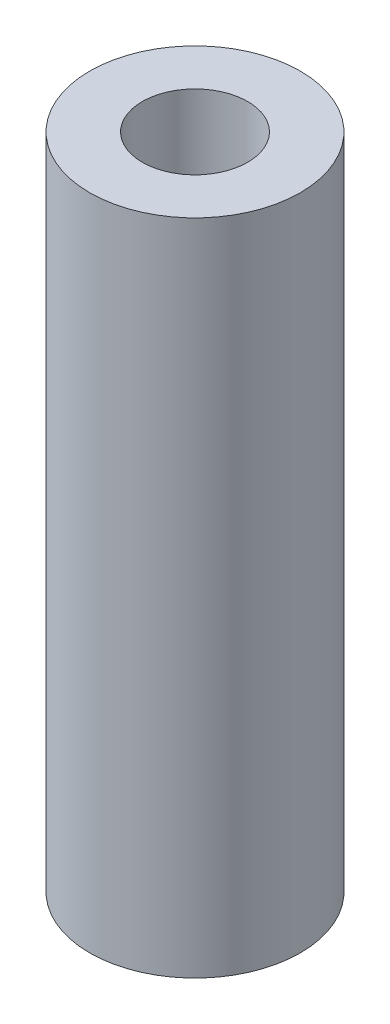
from build123d import *

# Parameters (mm, degrees)
SKETCH_1_R      = 4
SKETCH_1_R_2    = 2
EXTRUDE_1_DEPTH = 25


with BuildPart() as part:
    # 草图1 → 凸台-拉伸1 (new body)
    with BuildSketch(Plane(origin=(0, 0, 0), x_dir=(1, 0, 0), z_dir=(0, 1, 0))):
        with Locations(Location((0, 0, 0), (0, 0, 270))):
            Circle(SKETCH_1_R)
        with Locations(Location((0, 0, 0), (0, 0, 270))):
            Circle(SKETCH_1_R_2, mode=Mode.SUBTRACT)
    extrude(amount=EXTRUDE_1_DEPTH)


solid = part.part
